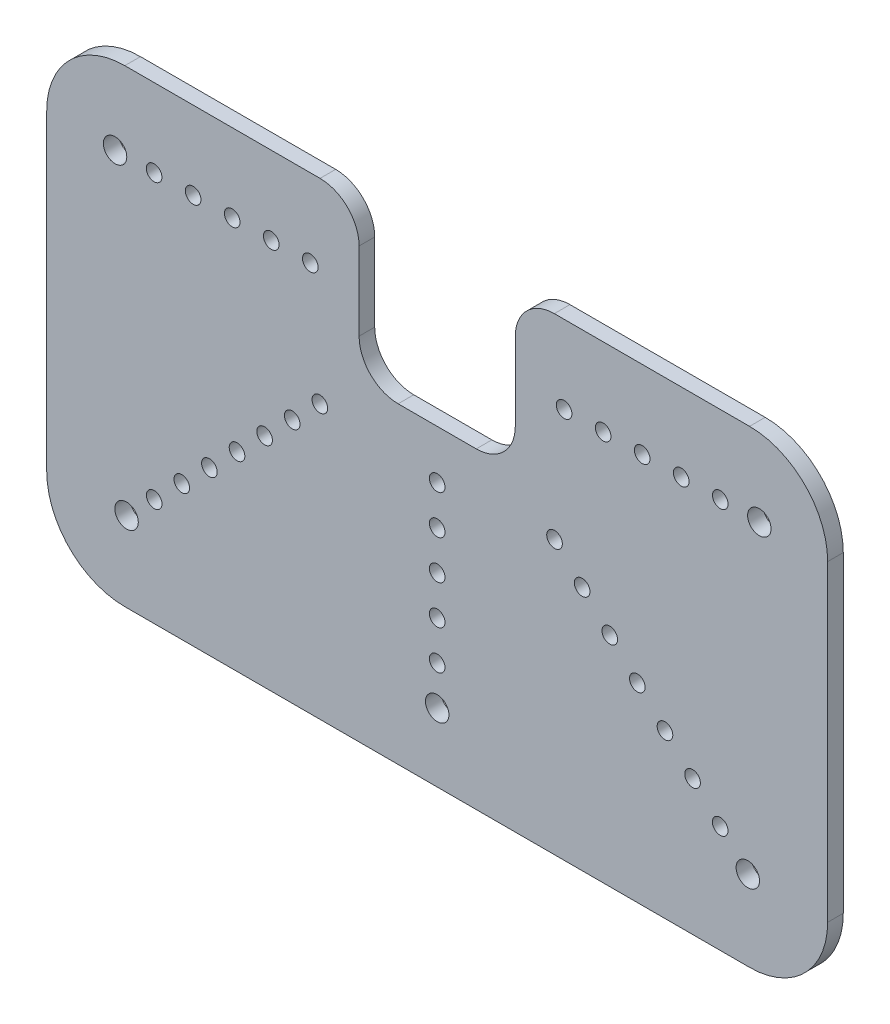
from build123d import *

# Parameters (mm, degrees)
SKETCH1_R           = 3
SKETCH1_R_2         = 2
BOSS_EXTRUDE1_DEPTH = 4
FILLET1_R           = 10
FILLET2_R           = 10
FILLET3_R           = 20


with BuildPart() as part:
    # Sketch1 → Boss-Extrude1 (new body)
    with BuildSketch(Plane.XY):
        Polygon((32.0494974, 36.578285273), (-47.9505026, 36.578285273), (-47.9505026, -3.421714727), (-87.9505026, -3.421714727), (-87.9505026, 36.578285273), (-167.9505026, 36.578285273), (-167.9505026, -83.421714727), (32.0494974, -83.421714727), align=None)
        with Locations((14.5494974, 16.578285273)):
            Circle(SKETCH1_R, mode=Mode.SUBTRACT)
        with Locations((-9.614193152, -41.758024175)):
            Circle(SKETCH1_R_2, mode=Mode.SUBTRACT)
        with Locations((-16.685260964, -34.686956363)):
            Circle(SKETCH1_R_2, mode=Mode.SUBTRACT)
        with Locations((-23.756328775, -27.615888551)):
            Circle(SKETCH1_R_2, mode=Mode.SUBTRACT)
        with Locations((-30.827396587, -20.544820739)):
            Circle(SKETCH1_R_2, mode=Mode.SUBTRACT)
        with Locations((-37.898464399, -13.473752928)):
            Circle(SKETCH1_R_2, mode=Mode.SUBTRACT)
        with Locations((-35.4505026, 16.578285273)):
            Circle(SKETCH1_R_2, mode=Mode.SUBTRACT)
        with Locations((-25.4505026, 16.578285273)):
            Circle(SKETCH1_R_2, mode=Mode.SUBTRACT)
        with Locations((-15.4505026, 16.578285273)):
            Circle(SKETCH1_R_2, mode=Mode.SUBTRACT)
        with Locations((-5.4505026, 16.578285273)):
            Circle(SKETCH1_R_2, mode=Mode.SUBTRACT)
        with Locations((4.5494974, 16.578285273)):
            Circle(SKETCH1_R_2, mode=Mode.SUBTRACT)
        with Locations((-2.54312534, -48.829091987)):
            Circle(SKETCH1_R_2, mode=Mode.SUBTRACT)
        with Locations((-67.9505026, -65.921714727)):
            Circle(SKETCH1_R, mode=Mode.SUBTRACT)
        with Locations((-67.9505026, -55.921714727)):
            Circle(SKETCH1_R_2, mode=Mode.SUBTRACT)
        with Locations((-67.9505026, -45.921714727)):
            Circle(SKETCH1_R_2, mode=Mode.SUBTRACT)
        with Locations((-67.9505026, -35.921714727)):
            Circle(SKETCH1_R_2, mode=Mode.SUBTRACT)
        with Locations((-67.9505026, -25.921714727)):
            Circle(SKETCH1_R_2, mode=Mode.SUBTRACT)
        with Locations((-67.9505026, -15.921714727)):
            Circle(SKETCH1_R_2, mode=Mode.SUBTRACT)
        with Locations((4.527942472, -55.900159799)):
            Circle(SKETCH1_R_2, mode=Mode.SUBTRACT)
        with Locations((-126.286812048, -41.758024175)):
            Circle(SKETCH1_R_2, mode=Mode.SUBTRACT)
        with Locations((-119.215744236, -34.686956363)):
            Circle(SKETCH1_R_2, mode=Mode.SUBTRACT)
        with Locations((-112.144676424, -27.615888551)):
            Circle(SKETCH1_R_2, mode=Mode.SUBTRACT)
        with Locations((-105.073608612, -20.544820739)):
            Circle(SKETCH1_R_2, mode=Mode.SUBTRACT)
        with Locations((-98.0025408, -13.473752928)):
            Circle(SKETCH1_R_2, mode=Mode.SUBTRACT)
        with Locations((11.599010284, -62.971227611)):
            Circle(SKETCH1_R, mode=Mode.SUBTRACT)
        with Locations((-150.4505026, 16.578285273)):
            Circle(SKETCH1_R, mode=Mode.SUBTRACT)
        with Locations((-140.4505026, 16.578285273)):
            Circle(SKETCH1_R_2, mode=Mode.SUBTRACT)
        with Locations((-130.4505026, 16.578285273)):
            Circle(SKETCH1_R_2, mode=Mode.SUBTRACT)
        with Locations((-120.4505026, 16.578285273)):
            Circle(SKETCH1_R_2, mode=Mode.SUBTRACT)
        with Locations((-110.4505026, 16.578285273)):
            Circle(SKETCH1_R_2, mode=Mode.SUBTRACT)
        with Locations((-100.4505026, 16.578285273)):
            Circle(SKETCH1_R_2, mode=Mode.SUBTRACT)
        with Locations((-133.357879859, -48.829091987)):
            Circle(SKETCH1_R_2, mode=Mode.SUBTRACT)
        with Locations((-140.428947671, -55.900159799)):
            Circle(SKETCH1_R_2, mode=Mode.SUBTRACT)
        with Locations((-147.500015483, -62.971227611)):
            Circle(SKETCH1_R, mode=Mode.SUBTRACT)
    extrude(amount=BOSS_EXTRUDE1_DEPTH)

    # Fillet1
    fillet1_edges = [part.edges().sort_by_distance(p)[0] for p in [
        (-87.9505026, -3.421714727, 2),
        (-47.9505026, -3.421714727, 2),
    ]]
    fillet(fillet1_edges, radius=FILLET1_R)

    # Fillet2
    fillet2_edges = [part.edges().sort_by_distance(p)[0] for p in [
        (-47.9505026, 36.578285273, 2),
        (-87.9505026, 36.578285273, 2),
    ]]
    fillet(fillet2_edges, radius=FILLET2_R)

    # Fillet3
    fillet3_edges = [part.edges().sort_by_distance(p)[0] for p in [
        (32.0494974, 36.578285273, 2),
        (32.0494974, -83.421714727, 2),
        (-167.9505026, -83.421714727, 2),
        (-167.9505026, 36.578285273, 2),
    ]]
    fillet(fillet3_edges, radius=FILLET3_R)


solid = part.part
